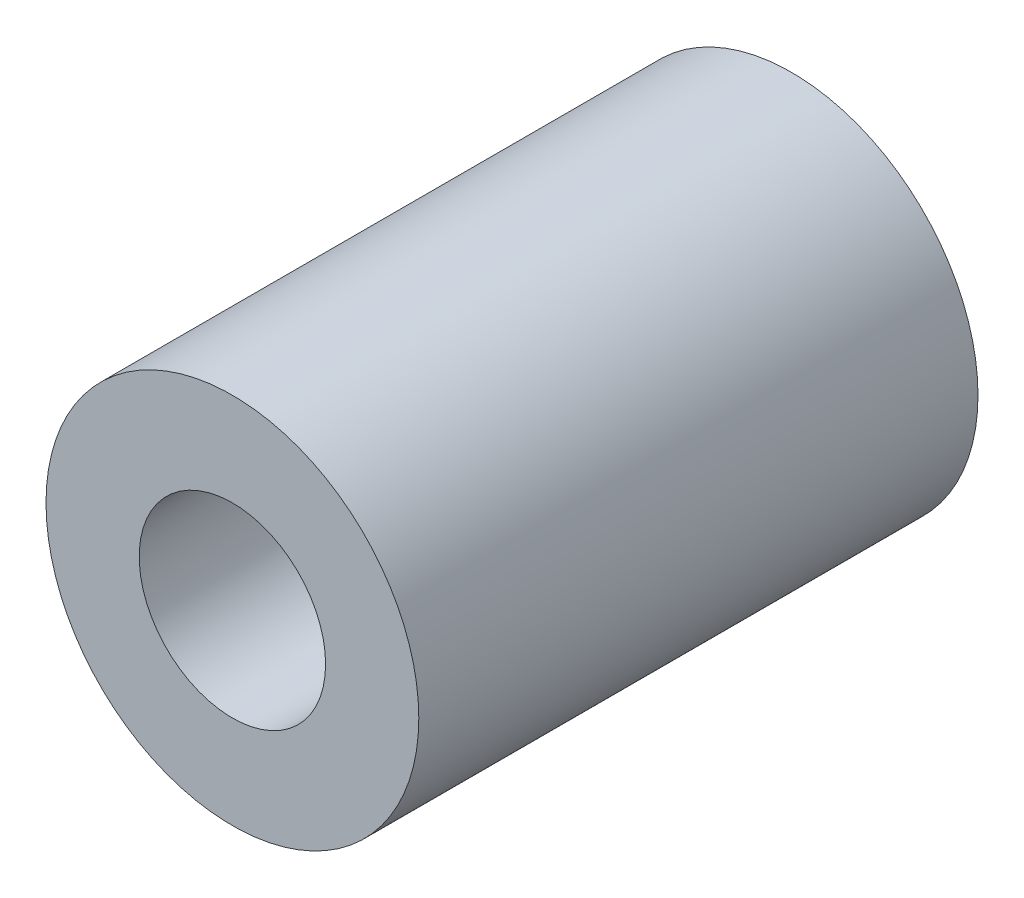
from build123d import *

# Parameters (mm, degrees)
SKETCH1_R           = 5
SKETCH1_R_2         = 2.5
BOSS_EXTRUDE1_DEPTH = 15


with BuildPart() as part:
    # Sketch1 → Boss-Extrude1 (new body)
    with BuildSketch(Plane.XY):
        Circle(SKETCH1_R)
        Circle(SKETCH1_R_2, mode=Mode.SUBTRACT)
    extrude(amount=BOSS_EXTRUDE1_DEPTH)


solid = part.part
